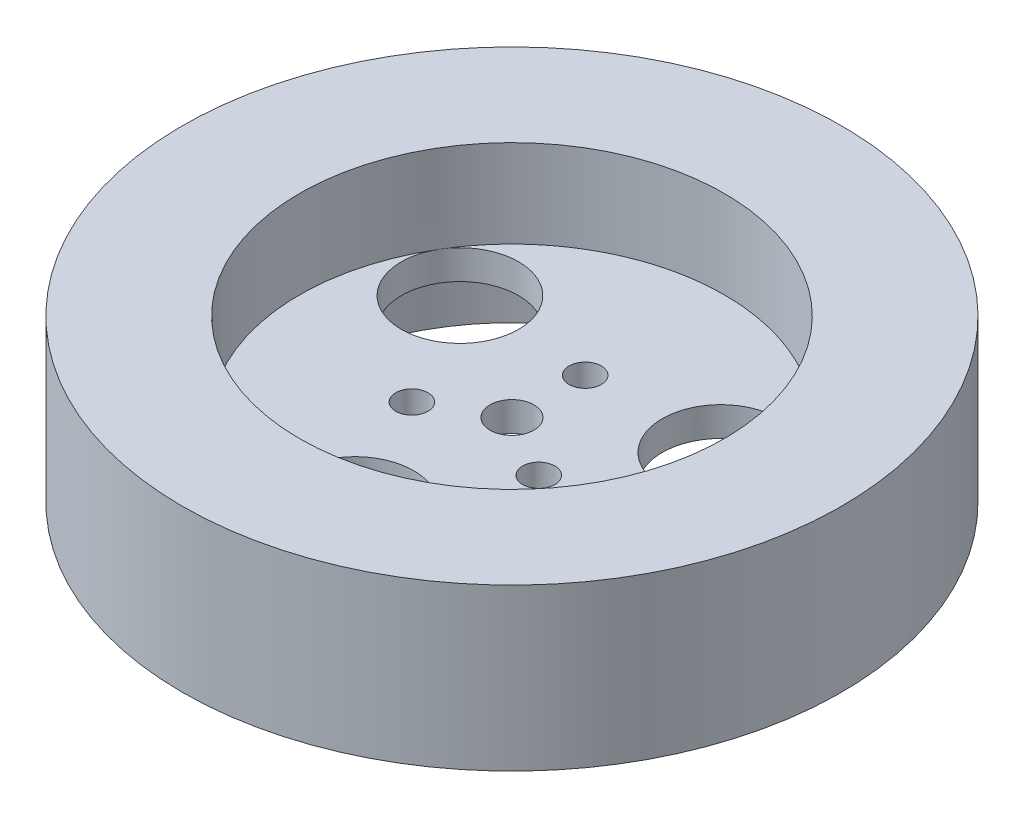
from build123d import *

# Parameters (mm, degrees)
SKETCH1_R           = 22.5
BOSS_EXTRUDE1_DEPTH = 11
SKETCH2_R           = 14.5
CUT_EXTRUDE1_DEPTH  = 6
SKETCH3_R           = 15
CUT_EXTRUDE2_DEPTH  = 3
CUT_EXTRUDE3_REACH  = 34.381
SKETCH4_R           = 1.5
SKETCH4_R_2         = 1.1
SKETCH4_R_3         = 4


with BuildPart() as part:
    # Sketch1 → Boss-Extrude1 (new body)
    with BuildSketch(Plane(origin=(0, 0, 0), x_dir=(1, 0, 0), z_dir=(0, 1, 0))):
        with Locations(Location((0, 0, 0), (0, 0, 270))):
            Circle(SKETCH1_R)
    extrude(amount=BOSS_EXTRUDE1_DEPTH)

    # Sketch2 → Cut-Extrude1 (cut)
    with BuildSketch(Plane(origin=(0, 11, 0), x_dir=(1, 0, 0), z_dir=(0, 1, 0))):
        with Locations(Location((0, 0, 0), (0, 0, 270))):
            Circle(SKETCH2_R)
    extrude(amount=-CUT_EXTRUDE1_DEPTH, mode=Mode.SUBTRACT)

    # Sketch3 → Cut-Extrude2 (cut)
    with BuildSketch(Plane.XZ):
        with Locations(Location((0, 0, 0), (0, 0, 270))):
            Circle(SKETCH3_R)
    extrude(amount=-CUT_EXTRUDE2_DEPTH, mode=Mode.SUBTRACT)

    # Sketch4 → Cut-Extrude3 (cut, up to next)
    with BuildSketch(Plane(origin=(0, 5, 0), x_dir=(1, 0, 0), z_dir=(0, 1, 0)), mode=Mode.PRIVATE) as cut_extrude3_sk1:
        with Locations(Location((0, 0, 0), (0, 0, 270))):
            Circle(SKETCH4_R)
    cut_extrude3_tool1 = extrude(cut_extrude3_sk1.sketch, amount=-CUT_EXTRUDE3_REACH, mode=Mode.PRIVATE) & part.part
    # Sketch4 → Cut-Extrude3 (cut, up to next)
    with BuildSketch(Plane(origin=(0, 5, 0), x_dir=(1, 0, 0), z_dir=(0, 1, 0)), mode=Mode.PRIVATE) as cut_extrude3_sk2:
        with Locations(Location((0, 5, 0), (0, 0, 270))):
            Circle(SKETCH4_R_2)
    cut_extrude3_tool2 = extrude(cut_extrude3_sk2.sketch, amount=-CUT_EXTRUDE3_REACH, mode=Mode.PRIVATE) & part.part
    # Sketch4 → Cut-Extrude3 (cut, up to next)
    with BuildSketch(Plane(origin=(0, 5, 0), x_dir=(1, 0, 0), z_dir=(0, 1, 0)), mode=Mode.PRIVATE) as cut_extrude3_sk3:
        with Locations(Location((4.330127019, -2.5, 0), (0, 0, 270))):
            Circle(SKETCH4_R_2)
    cut_extrude3_tool3 = extrude(cut_extrude3_sk3.sketch, amount=-CUT_EXTRUDE3_REACH, mode=Mode.PRIVATE) & part.part
    # Sketch4 → Cut-Extrude3 (cut, up to next)
    with BuildSketch(Plane(origin=(0, 5, 0), x_dir=(1, 0, 0), z_dir=(0, 1, 0)), mode=Mode.PRIVATE) as cut_extrude3_sk4:
        with Locations(Location((-4.330127019, -2.5, 0), (0, 0, 270))):
            Circle(SKETCH4_R_2)
    cut_extrude3_tool4 = extrude(cut_extrude3_sk4.sketch, amount=-CUT_EXTRUDE3_REACH, mode=Mode.PRIVATE) & part.part
    # Sketch4 → Cut-Extrude3 (cut, up to next)
    with BuildSketch(Plane(origin=(0, 5, 0), x_dir=(1, 0, 0), z_dir=(0, 1, 0)), mode=Mode.PRIVATE) as cut_extrude3_sk5:
        with Locations(Location((9.198755892, 5.062893446, 0), (0, 0, 28.828375855))):
            Circle(SKETCH4_R_3)
    cut_extrude3_tool5 = extrude(cut_extrude3_sk5.sketch, amount=-CUT_EXTRUDE3_REACH, mode=Mode.PRIVATE) & part.part
    # Sketch4 → Cut-Extrude3 (cut, up to next)
    with BuildSketch(Plane(origin=(0, 5, 0), x_dir=(1, 0, 0), z_dir=(0, 1, 0)), mode=Mode.PRIVATE) as cut_extrude3_sk6:
        with Locations(Location((-0.214783605, -10.497803008, 0), (0, 0, 268.828376506))):
            Circle(SKETCH4_R_3)
    cut_extrude3_tool6 = extrude(cut_extrude3_sk6.sketch, amount=-CUT_EXTRUDE3_REACH, mode=Mode.PRIVATE) & part.part
    # Sketch4 → Cut-Extrude3 (cut, up to next)
    with BuildSketch(Plane(origin=(0, 5, 0), x_dir=(1, 0, 0), z_dir=(0, 1, 0)), mode=Mode.PRIVATE) as cut_extrude3_sk7:
        with Locations(Location((-8.983972287, 5.434909563, 0), (0, 0, 148.828375289))):
            Circle(SKETCH4_R_3)
    cut_extrude3_tool7 = extrude(cut_extrude3_sk7.sketch, amount=-CUT_EXTRUDE3_REACH, mode=Mode.PRIVATE) & part.part
    add(cut_extrude3_tool1.solids().sort_by_distance((0, 5, 0))[0], mode=Mode.SUBTRACT)
    add(cut_extrude3_tool2.solids().sort_by_distance((0, 5, -5))[0], mode=Mode.SUBTRACT)
    add(cut_extrude3_tool3.solids().sort_by_distance((4.330127, 5, 2.5))[0], mode=Mode.SUBTRACT)
    add(cut_extrude3_tool4.solids().sort_by_distance((-4.330127, 5, 2.5))[0], mode=Mode.SUBTRACT)
    add(cut_extrude3_tool5.solids().sort_by_distance((9.198756, 5, -5.062893))[0], mode=Mode.SUBTRACT)
    add(cut_extrude3_tool6.solids().sort_by_distance((-0.214784, 5, 10.497803))[0], mode=Mode.SUBTRACT)
    add(cut_extrude3_tool7.solids().sort_by_distance((-8.983972, 5, -5.43491))[0], mode=Mode.SUBTRACT)


solid = part.part
